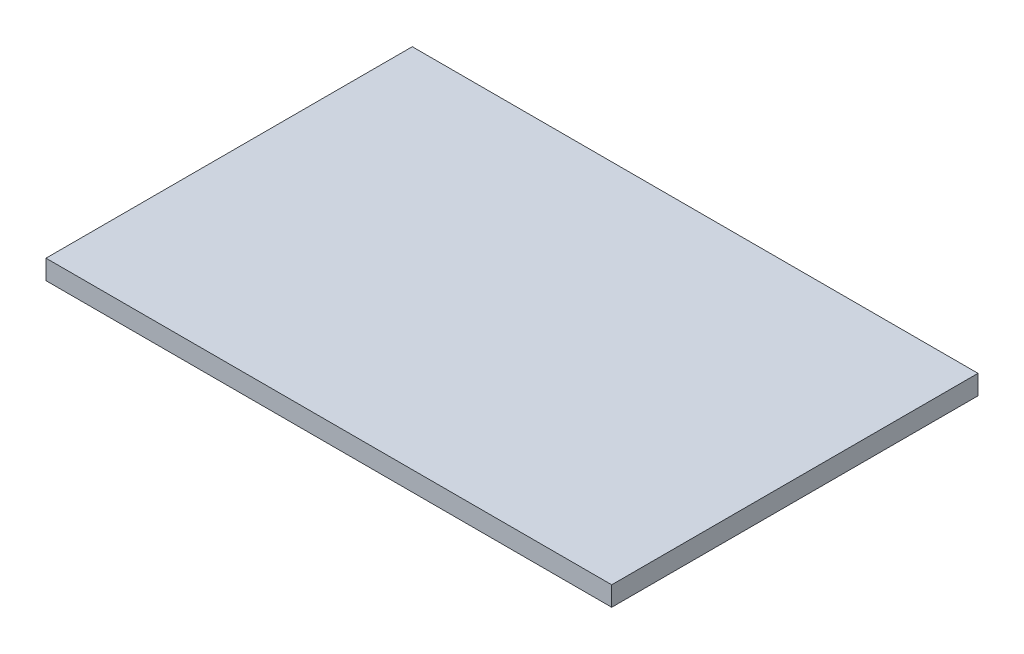
from build123d import *

# Parameters (mm, degrees)
SKETCH1_W           = 42.04
SKETCH1_H           = 27.22
BOSS_EXTRUDE1_DEPTH = 1.45


with BuildPart() as part:
    # Sketch1 → Boss-Extrude1 (new body)
    with BuildSketch(Plane(origin=(0, 0, 0), x_dir=(1, 0, 0), z_dir=(0, 1, 0))):
        with Locations((0, -2.095)):
            Rectangle(SKETCH1_W, SKETCH1_H)
    extrude(amount=BOSS_EXTRUDE1_DEPTH)


solid = part.part
